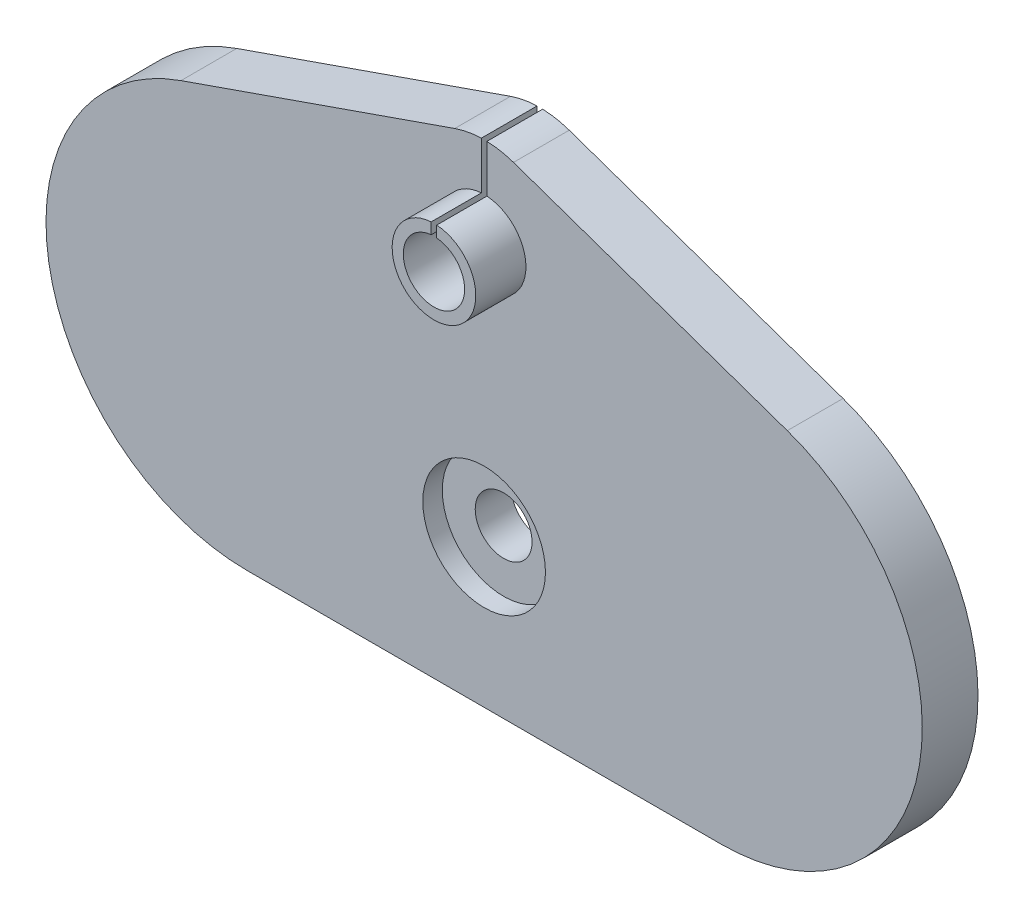
from build123d import *

# Parameters (mm, degrees)
SKETCH1_R           = 6
SKETCH1_R_2         = 11
BOSS_EXTRUDE1_DEPTH = 10
SKETCH2_R           = 7.5
SKETCH2_R_2         = 5.5
BOSS_EXTRUDE2_DEPTH = 9
SKETCH3_R           = 11
SKETCH3_R_2         = 5.1
BOSS_EXTRUDE3_DEPTH = 6.5
SKETCH4_W           = 1
SKETCH4_H           = 19
CUT_EXTRUDE1_DEPTH  = 14


with BuildPart() as part:
    # Sketch1 → Boss-Extrude1 (new body)
    with BuildSketch(Plane.XY):
        with BuildLine():
            ThreePointArc((5.266349667, -0.891540079), (0, 0), (-5.266349667, -0.891540079))
            Line((-5.266349667, -0.891540079), (-54.380555702, -18.011258697))
            ThreePointArc((-54.380555702, -18.011258697), (-78.08863349, -58.119798033), (-42.5, -88.19))
            Line((-42.5, -88.19), (42.5, -88.19))
            ThreePointArc((42.5, -88.19), (78.08863349, -58.119798033), (54.380555702, -18.011258697))
            Line((54.380555702, -18.011258697), (5.266349667, -0.891540079))
        make_face()
        with Locations((0, -16)):
            Circle(SKETCH1_R, mode=Mode.SUBTRACT)
        with Locations((0, -61.697507746)):
            Circle(SKETCH1_R_2, mode=Mode.SUBTRACT)
    extrude(amount=BOSS_EXTRUDE1_DEPTH)

    # Sketch2 → Boss-Extrude2 (add)
    with BuildSketch(Plane.XY.offset(10)):
        with Locations((0, -16)):
            Circle(SKETCH2_R)
        with Locations((0, -16)):
            Circle(SKETCH2_R_2, mode=Mode.SUBTRACT)
    extrude(amount=BOSS_EXTRUDE2_DEPTH)

    # Sketch3 → Boss-Extrude3 (add)
    with BuildSketch(Plane(origin=(0, 0, 0), x_dir=(-1, 0, 0), z_dir=(0, 0, -1))):
        with Locations((0, -61.697507746)):
            Circle(SKETCH3_R)
        with Locations((0, -61.697507746)):
            Circle(SKETCH3_R_2, mode=Mode.SUBTRACT)
    extrude(amount=-BOSS_EXTRUDE3_DEPTH)

    # Sketch4 → Cut-Extrude1 (cut)
    with BuildSketch(Plane(origin=(0, 1.81, 0), x_dir=(-1, 0, 0), z_dir=(0, -1, 0))):
        with Locations((0, -9.5)):
            Rectangle(SKETCH4_W, SKETCH4_H)
    extrude(amount=CUT_EXTRUDE1_DEPTH, mode=Mode.SUBTRACT)


solid = part.part
